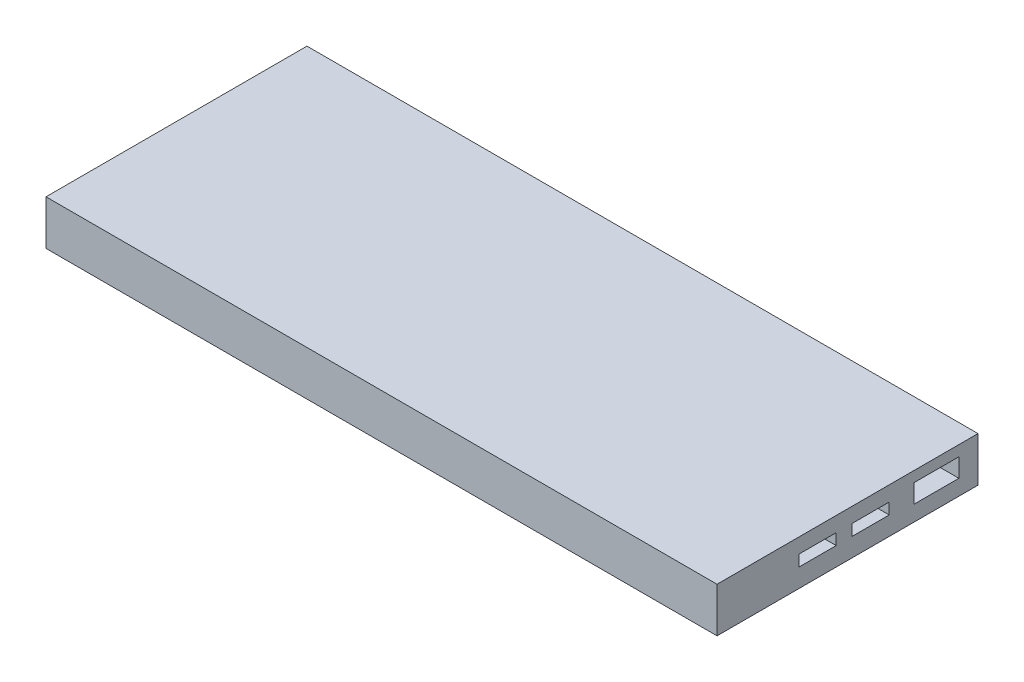
from build123d import *

# Parameters (mm, degrees)
SKETCH1_W           = 180
SKETCH1_H           = 70
BOSS_EXTRUDE1_DEPTH = 12
SKETCH2_W           = 12
SKETCH2_H           = 5
SKETCH2_W_2         = 10
SKETCH2_H_2         = 3
CUT_EXTRUDE1_DEPTH  = 10


with BuildPart() as part:
    # Sketch1 → Boss-Extrude1 (new body)
    with BuildSketch(Plane(origin=(0, 0, 0), x_dir=(1, 0, 0), z_dir=(0, 1, 0))):
        Rectangle(SKETCH1_W, SKETCH1_H)
    extrude(amount=BOSS_EXTRUDE1_DEPTH)

    # Sketch2 → Cut-Extrude1 (cut)
    with BuildSketch(Plane(origin=(90, 0, 0), x_dir=(0, 0, -1), z_dir=(1, 0, 0))):
        with Locations((23.874882844, 6.669745757)):
            Rectangle(SKETCH2_W, SKETCH2_H)
        with Locations((6.186906041, 6.5)):
            Rectangle(SKETCH2_W_2, SKETCH2_H_2)
        with Locations((-8.043438812, 6.5)):
            Rectangle(SKETCH2_W_2, SKETCH2_H_2)
    extrude(amount=-CUT_EXTRUDE1_DEPTH, mode=Mode.SUBTRACT)


solid = part.part
